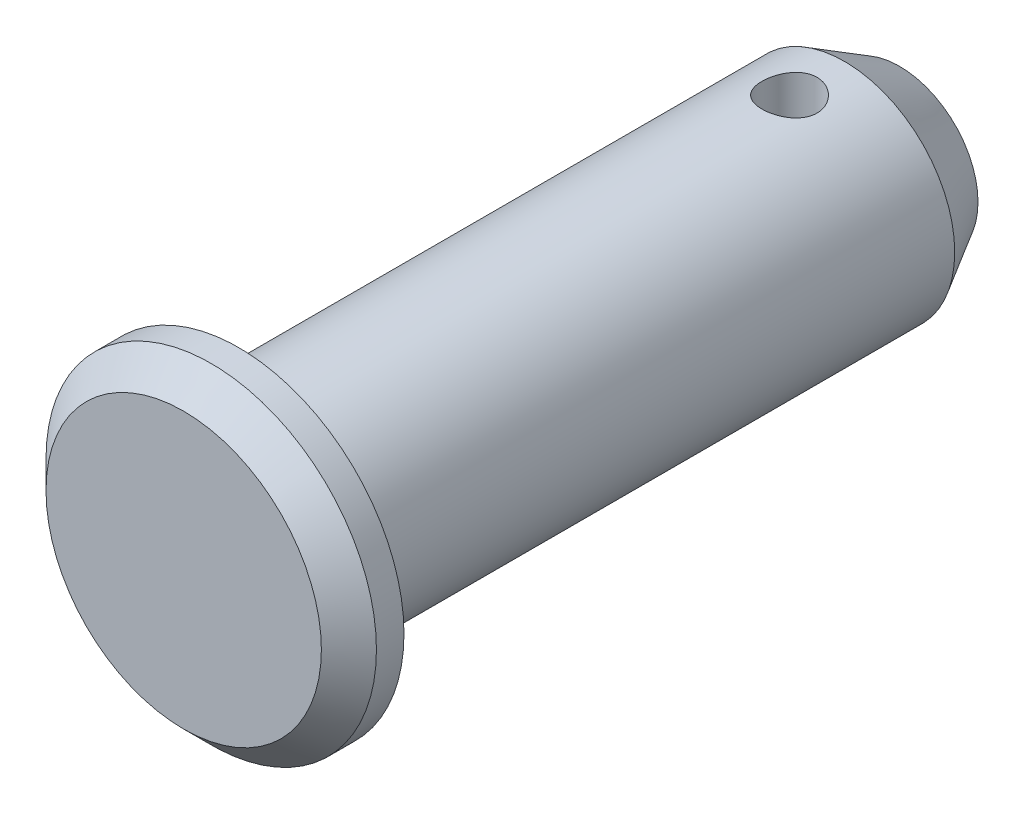
from build123d import *

# Parameters (mm, degrees)
WYTNIJ_WYCI_GNI_CIE1_DEPTH      = 8.762087348
WYTNIJ_WYCI_GNI_CIE1_DEPTH_BACK = 8.762087348
SZKIC2_R                        = 0.5


with BuildPart() as part:
    # Szkic1 → Obrót1 (revolve)
    with BuildSketch(Plane(origin=(0, 0, 0), x_dir=(1, 0, 0), z_dir=(0, 1, 0))):
        Polygon((0, -6.5), (2.5, -6.5), (3, -6), (3, -5.5), (2, -5.5), (2, 5.5), (1.422649731, 6.5), (0, 6.5), align=None)
    revolve(axis=Axis((0, 0, 6.5), (0, 0, -1)))

    # Szkic2 → Wytnij-wyciągnięcie1 (cut, two sides: drawn at the far end of the back side and taken through both)
    with BuildSketch(Plane(origin=(0, 0, 0), x_dir=(1, 0, 0), z_dir=(0, 1, 0)).offset(-WYTNIJ_WYCI_GNI_CIE1_DEPTH_BACK)):
        with Locations(Location((0, 4.5, 0), (0, 0, 270))):
            Circle(SZKIC2_R)
    extrude(amount=WYTNIJ_WYCI_GNI_CIE1_DEPTH + WYTNIJ_WYCI_GNI_CIE1_DEPTH_BACK, mode=Mode.SUBTRACT)


solid = part.part
